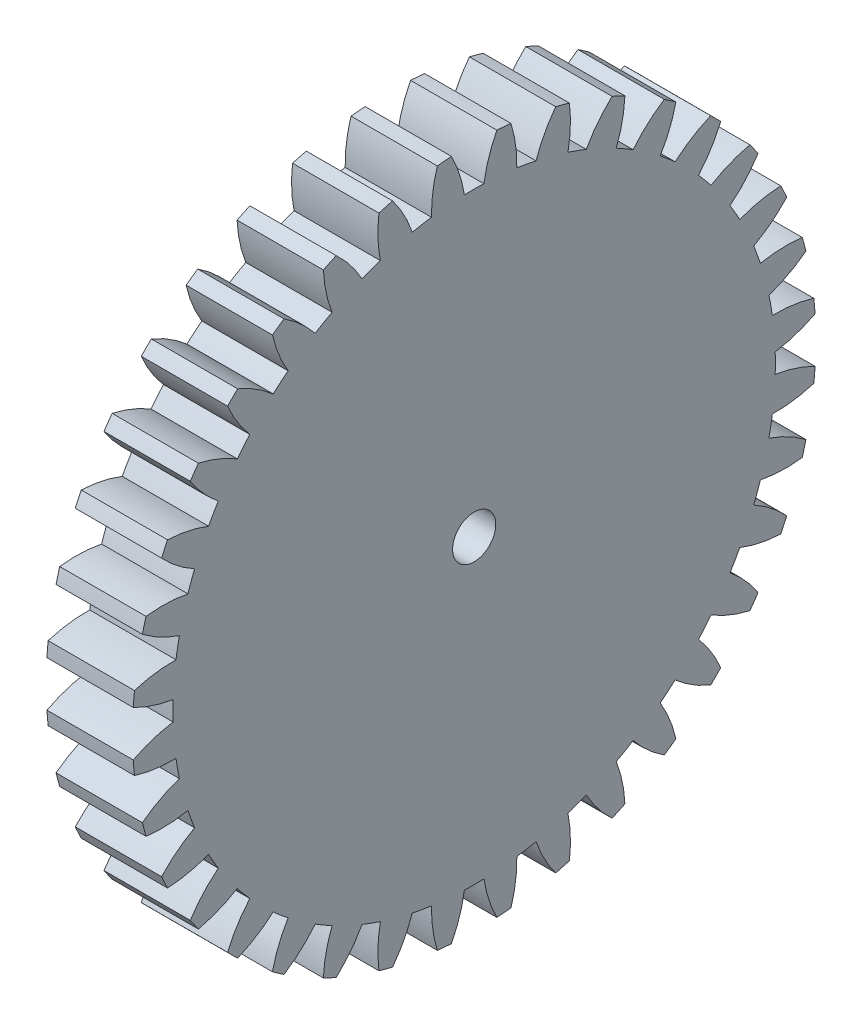
from build123d import *

# Parameters (mm, degrees)
BASPROSKE_W             = 12
BASPROSKE_H             = 47.5
TOOTHCUT_DEPTH          = 69.238552153
TEETHCUTS_COUNT         = 36
TEETHCUTS_ANGLE         = 350
BORSKE_R                = 4
BORE_DEPTH              = 50.0000508
KEYSKE_W                = 3
KEYSKE_H                = 5.4
KEYWAY_DEPTH            = 50.0000508
KEYWAY2_COUNT           = 2
KEYWAY2_ANGLE           = 90
SKETCH1_R               = 6
SKETCH1_R_2             = 3
BOSS_EXTRUDE1_DEPTH     = 20
CUT_EXTRUDE1_DEPTH      = 10
CUT_EXTRUDE1_DEPTH_BACK = 15
SKETCH2_R               = 1.5


with BuildPart() as part:
    # BasProSke → Base-Revolve (revolve)
    with BuildSketch(Plane(origin=(0, 0, 0), x_dir=(1, 0, 0), z_dir=(0, 1, 0)), mode=Mode.PRIVATE) as base_revolve_sk:
        with Locations((6, 23.75)):
            Rectangle(BASPROSKE_W, BASPROSKE_H)
    revolve(base_revolve_sk.sketch.rotate(Axis((-10, 0, 0), (1, 0, 0)), 180), axis=Axis((-10, 0, 0), (1, 0, 0)))

    # TooCutSke → ToothCut (cut, through all)
    with BuildSketch(Plane(origin=(0, 0, 0), x_dir=(0, 0, -1), z_dir=(1, 0, 0))):
        with BuildLine():
            ThreePointArc((1.355657572, 41.852049753), (0, 41.874), (-1.355657572, 41.852049753))
            ThreePointArc((-1.355657572, 41.852049753), (-2.034951545, 44.710079969), (-3.170081619, 47.41955533))
            ThreePointArc((-3.170081619, 47.41955533), (0, 47.5254), (3.170081619, 47.41955533))
            ThreePointArc((3.170081619, 47.41955533), (2.034951545, 44.710079969), (1.355657572, 41.852049753))
        make_face()
    toothcut = extrude(amount=TOOTHCUT_DEPTH, mode=Mode.SUBTRACT)

    # TeethCuts: ToothCut ×36 about axis
    teethcuts_axis = Axis((-10, 0, 0), (1, 0, 0))
    for i in range(1, TEETHCUTS_COUNT):
        add(toothcut.rotate(teethcuts_axis, i * TEETHCUTS_ANGLE / (TEETHCUTS_COUNT - 1)), mode=Mode.SUBTRACT)

    # BorSke → Bore (cut, symmetric)
    with BuildSketch(Plane(origin=(0, 0, 0), x_dir=(0, 0, -1), z_dir=(1, 0, 0))):
        with Locations(Location((0, 0, 0), (0, 0, 180))):
            Circle(BORSKE_R)
    extrude(amount=BORE_DEPTH, both=True, mode=Mode.SUBTRACT)

    # KeySke → Keyway (cut, symmetric)
    with BuildSketch(Plane(origin=(0, 0, 0), x_dir=(0, 0, -1), z_dir=(1, 0, 0))):
        with Locations((0, 2.7)):
            Rectangle(KEYSKE_W, KEYSKE_H)
    keyway = extrude(amount=KEYWAY_DEPTH, both=True, mode=Mode.SUBTRACT)

    # Keyway2: Keyway ×2 about axis
    keyway2_axis = Axis((0, 0, 0), (-1, 0, 0))
    for i in range(1, KEYWAY2_COUNT):
        add(keyway.rotate(keyway2_axis, i * KEYWAY2_ANGLE / (KEYWAY2_COUNT - 1)), mode=Mode.SUBTRACT)

    # Sketch1 → Boss-Extrude1 (add)
    with BuildSketch(Plane(origin=(12, 0, 0), x_dir=(0, 0, -1), z_dir=(1, 0, 0))):
        Circle(SKETCH1_R)
        Circle(SKETCH1_R_2, mode=Mode.SUBTRACT)
    extrude(amount=-BOSS_EXTRUDE1_DEPTH)

    # Sketch2 → Cut-Extrude1 (cut, two sides: drawn at the far end of the back side and taken through both)
    with BuildSketch(Plane(origin=(0, 0, 0), x_dir=(1, 0, 0), z_dir=(0, 1, 0)).offset(-CUT_EXTRUDE1_DEPTH_BACK)):
        with Locations(Location((-5, 0, 0), (0, 0, 90))):
            Circle(SKETCH2_R)
    extrude(amount=CUT_EXTRUDE1_DEPTH + CUT_EXTRUDE1_DEPTH_BACK, mode=Mode.SUBTRACT)


solid = part.part
